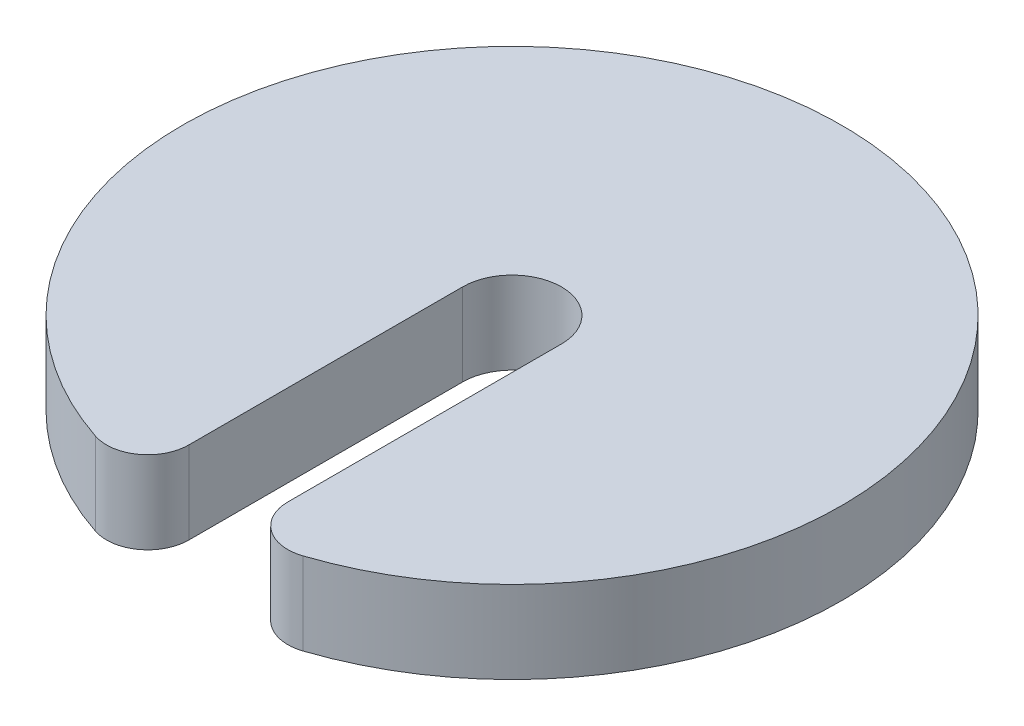
from build123d import *

# Parameters (mm, degrees)
BOSS_EXTRUDE1_DEPTH = 10


with BuildPart() as part:
    # Sketch1 → Boss-Extrude1 (new body)
    with BuildSketch(Plane(origin=(0, 0, 0), x_dir=(1, 0, 0), z_dir=(0, 1, 0))):
        with BuildLine():
            Line((6, 0), (6, -33.226495452))
            ThreePointArc((6, -33.226495452), (8.072299781, -37.279712869), (12.571428571, -37.973137659))
            ThreePointArc((12.571428571, -37.973137659), (0, 40), (-12.571428571, -37.973137659))
            ThreePointArc((-12.571428571, -37.973137659), (-8.072299781, -37.279712869), (-6, -33.226495452))
            Line((-6, -33.226495452), (-6, 0))
            ThreePointArc((-6, 0), (0, 6), (6, 0))
        make_face()
    extrude(amount=BOSS_EXTRUDE1_DEPTH)


solid = part.part
